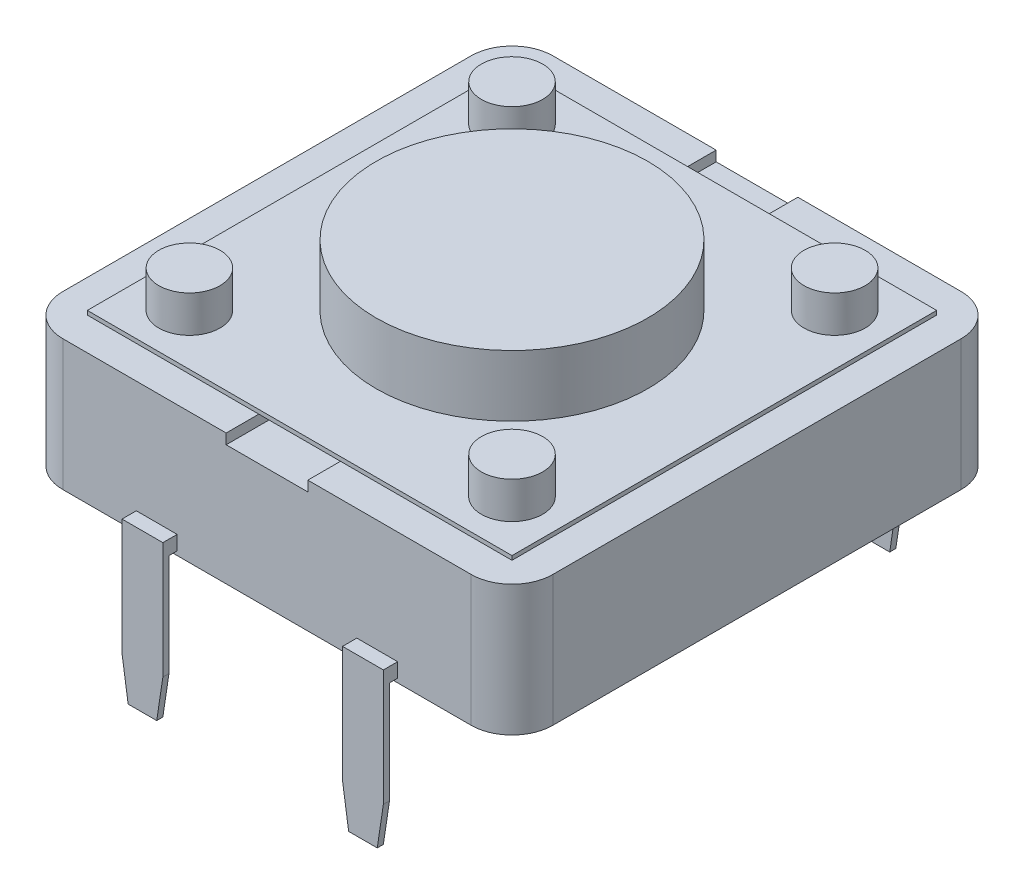
from build123d import *

# Parameters (mm, degrees)
SKETCH1_W           = 12
SKETCH1_H           = 12
BOSS_EXTRUDE1_DEPTH = 3.2
SKETCH2_R           = 0.75
BOSS_EXTRUDE2_DEPTH = 1
SKETCH3_W           = 10.4
SKETCH3_H           = 10.4
BOSS_EXTRUDE3_DEPTH = 0.1
SKETCH4_R           = 3.325
BOSS_EXTRUDE4_DEPTH = 1.5
FILLET1_R           = 1
SKETCH5_W           = 2
SKETCH5_H           = 12
CUT_EXTRUDE1_DEPTH  = 0.25
SKETCH6_W           = 1
SKETCH6_H           = 0.35
BOSS_EXTRUDE5_DEPTH = 0.35
SKETCH7_W           = 1
SKETCH7_H           = 0.15
BOSS_EXTRUDE6_DEPTH = 3.5
CUT_EXTRUDE4_DEPTH  = 18.876311141


with BuildPart() as part:
    # Sketch1 → Boss-Extrude1 (new body)
    with BuildSketch(Plane(origin=(0, 0, 0), x_dir=(1, 0, 0), z_dir=(0, 1, 0))):
        with Locations((6, 6)):
            Rectangle(SKETCH1_W, SKETCH1_H)
    extrude(amount=BOSS_EXTRUDE1_DEPTH)

    # Sketch2 → Boss-Extrude2 (add)
    with BuildSketch(Plane(origin=(0, 3.2, 0), x_dir=(1, 0, 0), z_dir=(0, 1, 0))):
        with Locations((2.05, 9.95)):
            Circle(SKETCH2_R)
        with Locations((9.95, 9.95)):
            Circle(SKETCH2_R)
        with Locations((2.05, 2.05)):
            Circle(SKETCH2_R)
        with Locations((9.95, 2.05)):
            Circle(SKETCH2_R)
    extrude(amount=BOSS_EXTRUDE2_DEPTH)

    # Sketch3 → Boss-Extrude3 (add)
    with BuildSketch(Plane(origin=(0, 3.2, 0), x_dir=(1, 0, 0), z_dir=(0, 1, 0))):
        with Locations((6, 6)):
            Rectangle(SKETCH3_W, SKETCH3_H)
    extrude(amount=BOSS_EXTRUDE3_DEPTH)

    # Sketch4 → Boss-Extrude4 (add)
    with BuildSketch(Plane(origin=(0, 3.3, 0), x_dir=(1, 0, 0), z_dir=(0, 1, 0))):
        with Locations((6, 6)):
            Circle(SKETCH4_R)
    extrude(amount=BOSS_EXTRUDE4_DEPTH)

    # Fillet1
    fillet1_edges = [part.edges().sort_by_distance(p)[0] for p in [
        (0, 1.6, -12),
        (0, 1.6, 0),
        (12, 1.6, 0),
        (12, 1.6, -12),
    ]]
    fillet(fillet1_edges, radius=FILLET1_R)

    # Sketch5 → Cut-Extrude1 (cut)
    with BuildSketch(Plane(origin=(0, 3.2, 0), x_dir=(1, 0, 0), z_dir=(0, 1, 0))):
        with Locations((6, 6)):
            Rectangle(SKETCH5_W, SKETCH5_H)
    extrude(amount=-CUT_EXTRUDE1_DEPTH, mode=Mode.SUBTRACT)

    # Sketch6 → Boss-Extrude5 (add)
    with BuildSketch(Plane.XY):
        with Locations((3.3, 0.275)):
            Rectangle(SKETCH6_W, SKETCH6_H)
        with Locations((8.7, 0.275)):
            Rectangle(SKETCH6_W, SKETCH6_H)
    boss_extrude5 = extrude(amount=BOSS_EXTRUDE5_DEPTH)

    # Sketch7 → Boss-Extrude6 (add)
    with BuildSketch(Plane.XZ.offset(-0.1)):
        with Locations((3.3, 0.275)):
            Rectangle(SKETCH7_W, SKETCH7_H)
        with Locations((8.7, 0.275)):
            Rectangle(SKETCH7_W, SKETCH7_H)
    boss_extrude6 = extrude(amount=BOSS_EXTRUDE6_DEPTH)

    # Sketch8 → Cut-Extrude4 (cut, through all)
    with BuildSketch(Plane.XY.offset(0.35)):
        Polygon((3.8, -2.4), (3.65, -3.4), (3.8, -3.4), align=None)
        Polygon((2.95, -3.4), (2.8, -2.4), (2.8, -3.4), align=None)
        Polygon((8.35, -3.4), (8.2, -2.4), (8.2, -3.4), align=None)
        Polygon((9.2, -3.4), (9.2, -2.4), (9.05, -3.4), align=None)
    cut_extrude4 = extrude(amount=-CUT_EXTRUDE4_DEPTH, mode=Mode.SUBTRACT)

    # Mirror1: Boss-Extrude5, Boss-Extrude6, Cut-Extrude4 across plane
    add(boss_extrude5.mirror(Plane.XY.offset(-6)))
    add(boss_extrude6.mirror(Plane.XY.offset(-6)))
    add(cut_extrude4.mirror(Plane.XY.offset(-6)), mode=Mode.SUBTRACT)


solid = part.part
